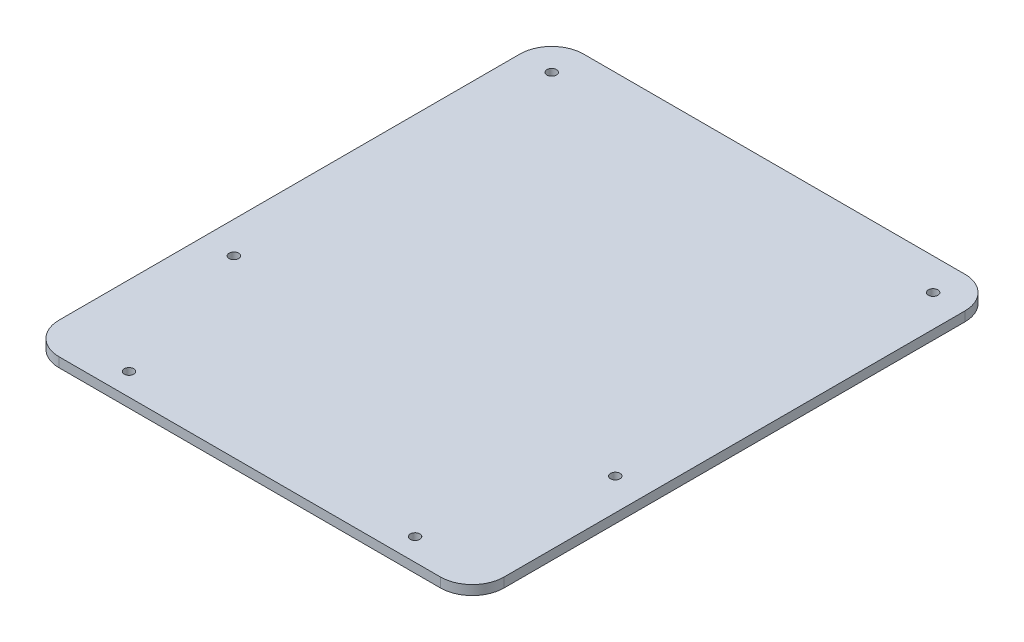
from build123d import *

# Parameters (mm, degrees)
EXTRUDE_1_DEPTH     = 3
SKETCH_2_R          = 1.5
CUT_EXTRUDE_1_DEPTH = 3
FILLET_1_R          = 10
SKETCH_3_W          = 140
SKETCH_3_H          = 45
CUT_EXTRUDE_2_DEPTH = 10
FILLET_2_R          = 10


with BuildPart() as part:
    # 草图1 → 凸台-拉伸1 (new body)
    with BuildSketch(Plane(origin=(0, 0, 0), x_dir=(1, 0, 0), z_dir=(0, 1, 0))):
        Polygon((70, 105), (-70, 105), (-70, 50), (-70, -50), (-70, -105), (70, -105), (70, -50), (70, 50), align=None)
    extrude(amount=EXTRUDE_1_DEPTH)

    # 草图2 → 切除-拉伸1 (cut)
    with BuildSketch(Plane(origin=(0, 3, 0), x_dir=(1, 0, 0), z_dir=(0, 1, 0))):
        with Locations(Location((-60, 50, 0), (0, 0, 270))):
            Circle(SKETCH_2_R)
        with Locations(Location((60, 50, 0), (0, 0, 90))):
            Circle(SKETCH_2_R)
        with Locations(Location((60, -50, 0), (0, 0, 270))):
            Circle(SKETCH_2_R)
        with Locations(Location((-60, -50, 0), (0, 0, 90))):
            Circle(SKETCH_2_R)
        with Locations(Location((-45, 98, 0), (0, 0, 270))):
            Circle(SKETCH_2_R)
        with Locations(Location((45, 98, 0), (0, 0, 90))):
            Circle(SKETCH_2_R)
        with Locations(Location((45, -98, 0), (0, 0, 270))):
            Circle(SKETCH_2_R)
        with Locations(Location((-45, -98, 0), (0, 0, 90))):
            Circle(SKETCH_2_R)
    extrude(amount=-CUT_EXTRUDE_1_DEPTH, mode=Mode.SUBTRACT)

    # 圆角1
    fillet_1_edges = [part.edges().sort_by_distance(p)[0] for p in [
        (-70, 1.5, 105),
        (70, 1.5, 105),
    ]]
    fillet(fillet_1_edges, radius=FILLET_1_R)

    # 草图3 → 切除-拉伸2 (cut)
    with BuildSketch(Plane(origin=(0, 3, 0), x_dir=(1, 0, 0), z_dir=(0, 1, 0))):
        with Locations((0, 82.5)):
            Rectangle(SKETCH_3_W, SKETCH_3_H)
    extrude(amount=-CUT_EXTRUDE_2_DEPTH, mode=Mode.SUBTRACT)

    # 圆角2
    fillet_2_edges = [part.edges().sort_by_distance(p)[0] for p in [
        (70, 1.5, -60),
        (-70, 1.5, -60),
    ]]
    fillet(fillet_2_edges, radius=FILLET_2_R)


solid = part.part
